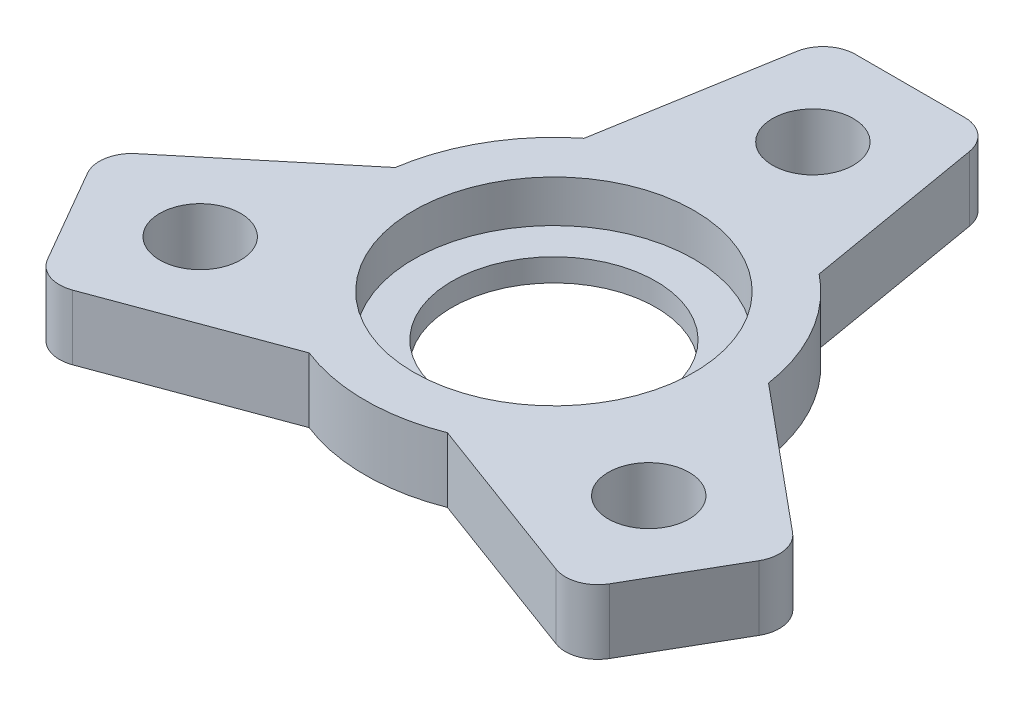
from build123d import *

# Parameters (mm, degrees)
SKETCH2_R                   = 11
BOSS_EXTRUDE1_DEPTH         = 5.08
SKETCH2_6_R                 = 11
SKETCH2_6_R_2               = 8
BOSS_EXTRUDE2_DEPTH         = 1.778
F_1_4_0_25_DIAMETER_HOLE3_D = 6.35
FILLET3_R                   = 2.54
CIRPATTERN2_COUNT           = 3


with BuildPart() as part:
    # Sketch2 → Boss-Extrude1 (new body)
    with BuildSketch(Plane(origin=(0, 0, 0), x_dir=(1, 0, 0), z_dir=(0, 1, 0))):
        with BuildLine():
            Line((-6.428604647, 27.94), (-9.222115265, 11.588299705))
            ThreePointArc((-9.222115265, 11.588299705), (0, -14.81), (9.222115265, 11.588299705))
            Line((9.222115265, 11.588299705), (6.428604647, 27.94))
            Line((6.428604647, 27.94), (-6.428604647, 27.94))
        make_face()
        Circle(SKETCH2_R, mode=Mode.SUBTRACT)
    extrude(amount=BOSS_EXTRUDE1_DEPTH)

    # Sketch2<6> → Boss-Extrude2 (add)
    with BuildSketch(Plane(origin=(0, 0, 0), x_dir=(1, 0, 0), z_dir=(0, 1, 0))):
        Circle(SKETCH2_6_R)
        Circle(SKETCH2_6_R_2, mode=Mode.SUBTRACT)
    extrude(amount=BOSS_EXTRUDE2_DEPTH)

    # 1/4 (0.25) Diameter Hole3 (through all)
    with Locations(Plane(origin=(0, 0, -20.32), x_dir=(0, 0, -1), z_dir=(0, -1, 0))):
        with Locations((0, 0)):
            Hole(F_1_4_0_25_DIAMETER_HOLE3_D / 2)

    # Fillet3
    fillet3_edges = [part.edges().sort_by_distance(p)[0] for p in [
        (6.428604647, 2.54, -27.94),
        (-6.428604647, 2.54, -27.94),
    ]]
    fillet(fillet3_edges, radius=FILLET3_R)

    # CirPattern2: part ×3 about axis
    cirpattern2_axis = Axis((0, 1.778, 0), (0, -1, 0))


with BuildPart() as part_1:
    add(part.part)
    for i in range(1, CIRPATTERN2_COUNT):
        add(part.part.rotate(cirpattern2_axis, i * 360 / CIRPATTERN2_COUNT))


solid = part_1.part
